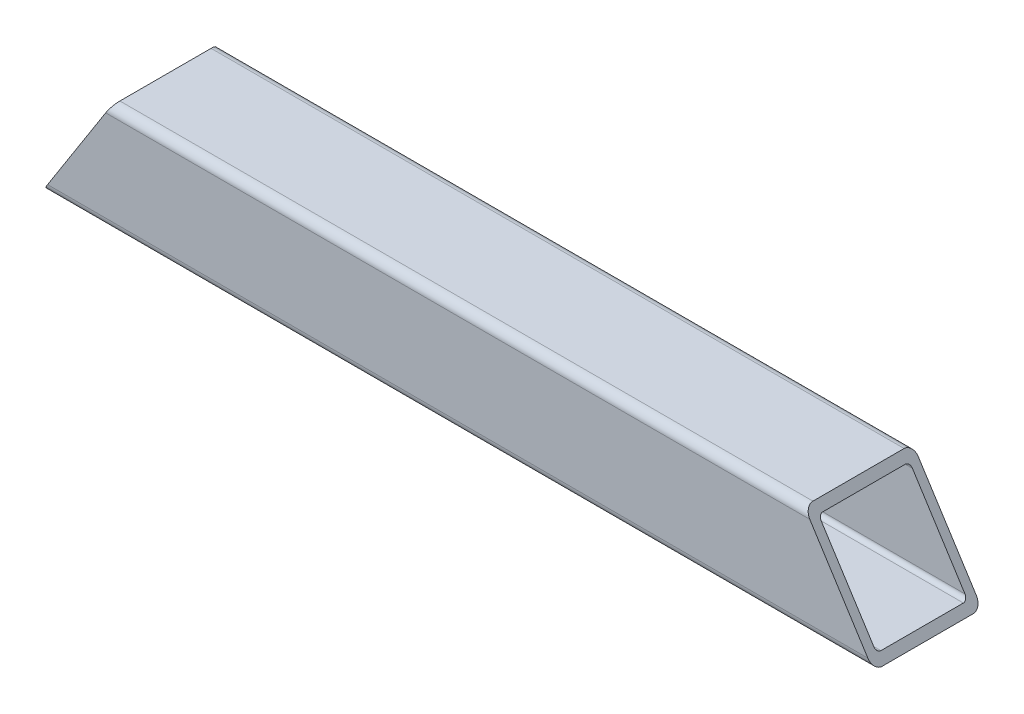
from build123d import *

# Parameters (mm, degrees)
HANDBRAKE_TOP_SUPPORT_EXTRUDE_DEPTH = 191.5
HANDBRAKE_TOP_SUPPORT_CUT_REACH     = 195.529


with BuildPart() as part:
    # Sketch1<8> → handbrake top support extrude (new body)
    with BuildSketch(Plane(origin=(0, 0, 0), x_dir=(0, 0, -1), z_dir=(1, 0, 0))):
        with BuildLine():
            Line((10.5, 12.5), (-10.5, 12.5))
            ThreePointArc((-10.5, 12.5), (-11.914213562, 11.914213562), (-12.5, 10.5))
            Line((-12.5, 10.5), (-12.5, -10.5))
            ThreePointArc((-12.5, -10.5), (-11.914213562, -11.914213562), (-10.5, -12.5))
            Line((-10.5, -12.5), (10.5, -12.5))
            ThreePointArc((10.5, -12.5), (11.914213562, -11.914213562), (12.5, -10.5))
            Line((12.5, -10.5), (12.5, 10.5))
            ThreePointArc((12.5, 10.5), (11.914213562, 11.914213562), (10.5, 12.5))
        make_face()
        with BuildLine():
            Line((-9.5, 10.5), (9.5, 10.5))
            ThreePointArc((9.5, 10.5), (10.207106781, 10.207106781), (10.5, 9.5))
            Line((10.5, 9.5), (10.5, -9.5))
            ThreePointArc((10.5, -9.5), (10.207106781, -10.207106781), (9.5, -10.5))
            Line((9.5, -10.5), (-9.5, -10.5))
            ThreePointArc((-9.5, -10.5), (-10.207106781, -10.207106781), (-10.5, -9.5))
            Line((-10.5, -9.5), (-10.5, 9.5))
            ThreePointArc((-10.5, 9.5), (-10.207106781, 10.207106781), (-9.5, 10.5))
        make_face(mode=Mode.SUBTRACT)
    extrude(amount=HANDBRAKE_TOP_SUPPORT_EXTRUDE_DEPTH)

    # Sketch7 → handbrake top support cut (cut, up to next)
    with BuildSketch(Plane.XY.offset(12.5), mode=Mode.PRIVATE) as handbrake_top_support_cut_sk1:
        Polygon((0, 12.5), (0, -12.5), (15.92675652, 12.5), align=None)
    handbrake_top_support_cut_tool1 = extrude(handbrake_top_support_cut_sk1.sketch, amount=-HANDBRAKE_TOP_SUPPORT_CUT_REACH, mode=Mode.PRIVATE) & part.part
    # Sketch7 → handbrake top support cut (cut, up to next)
    with BuildSketch(Plane.XY.offset(12.5), mode=Mode.PRIVATE) as handbrake_top_support_cut_sk2:
        Polygon((191.5, -12.5), (175.57324348, 12.5), (191.5, 12.5), align=None)
    handbrake_top_support_cut_tool2 = extrude(handbrake_top_support_cut_sk2.sketch, amount=-HANDBRAKE_TOP_SUPPORT_CUT_REACH, mode=Mode.PRIVATE) & part.part
    add(handbrake_top_support_cut_tool1.solids().sort_by_distance((5.308919, 4.166667, 12.5))[0], mode=Mode.SUBTRACT)
    add(handbrake_top_support_cut_tool2.solids().sort_by_distance((186.191081, 4.166667, 12.5))[0], mode=Mode.SUBTRACT)


solid = part.part
